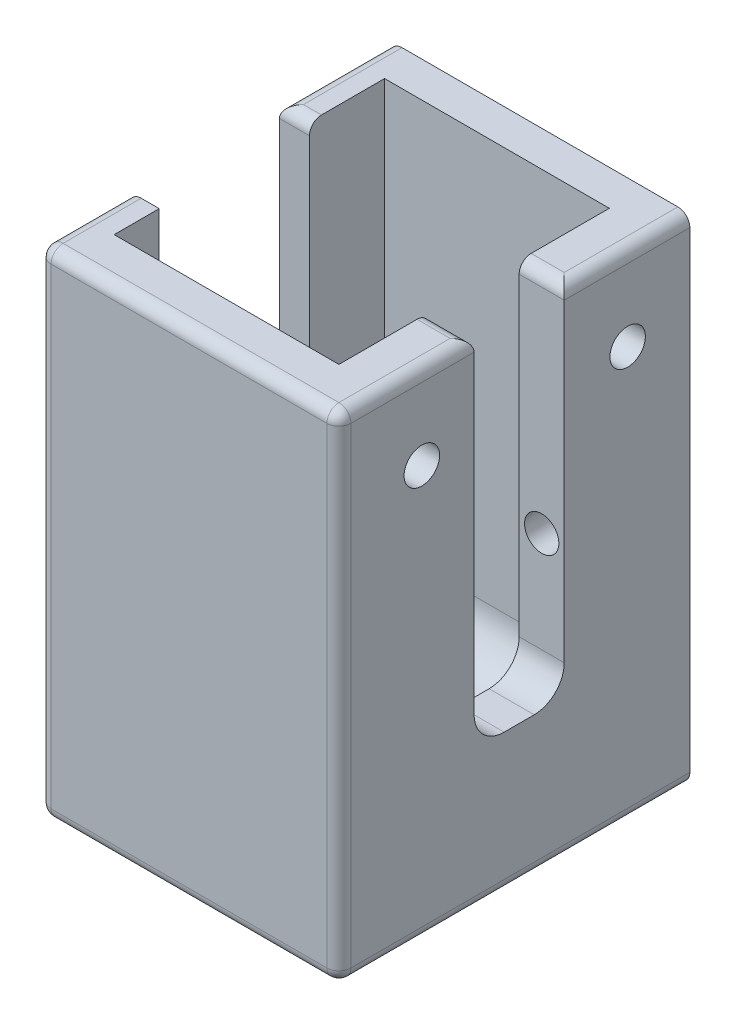
from build123d import *

# Parameters (mm, degrees)
BOSS_EXTRUDE2_DEPTH = 38.1
SKETCH1_W           = 25.35
SKETCH1_H           = 29.67
BOSS_EXTRUDE3_DEPTH = 3.81
SKETCH3_W           = 3
SKETCH3_H           = 7.62
CUT_EXTRUDE1_DEPTH  = 44.139583911
SKETCH4_W           = 7.62
SKETCH4_H           = 30.1
CUT_EXTRUDE2_DEPTH  = 47.344786115
SKETCH5_R           = 1.5
CUT_EXTRUDE3_DEPTH  = 47.344786115
SKETCH6_R           = 1.45
CUT_EXTRUDE4_DEPTH  = 24.844
FILLET1_R           = 4
FILLET4_R           = 2.54
FILLET2_R           = 1.016
FILLET3_R           = 1.27
FILLET5_R           = 1.016
CUT_EXTRUDE5_DEPTH  = 1.27
CUT_EXTRUDE6_DEPTH  = 1.27


with BuildPart() as part:
    # Sketch2 → Boss-Extrude2 (new body)
    with BuildSketch(Plane(origin=(0, 0, 0), x_dir=(1, 0, 0), z_dir=(0, 1, 0))):
        Polygon((-9.5, -11.43), (9.5, -11.43), (9.5, -5.08), (12.04, -5.08), (12.04, -14.43), (-13.31, -14.43), (-13.31, 15.24), (12.04, 15.24), (12.04, 7.62), (9.5, 7.62), (9.5, 11.43), (-9.5, 11.43), align=None)
    extrude(amount=BOSS_EXTRUDE2_DEPTH)

    # Sketch1 → Boss-Extrude3 (add)
    with BuildSketch(Plane(origin=(0, 0, 0), x_dir=(1, 0, 0), z_dir=(0, 1, 0))):
        with Locations((-0.635, 0.405)):
            Rectangle(SKETCH1_W, SKETCH1_H)
    extrude(amount=-BOSS_EXTRUDE3_DEPTH)

    # Sketch3 → Cut-Extrude1 (cut, through all)
    with BuildSketch(Plane(origin=(0, 0, 0), x_dir=(1, 0, 0), z_dir=(0, 1, 0))):
        with Locations((-0.38, 0)):
            Rectangle(SKETCH3_W, SKETCH3_H)
    extrude(amount=-CUT_EXTRUDE1_DEPTH, mode=Mode.SUBTRACT)

    # Sketch4 → Cut-Extrude2 (cut, through all)
    with BuildSketch(Plane(origin=(-9.5, 0, 0), x_dir=(0, 0, -1), z_dir=(1, 0, 0))):
        with Locations((0, 23.05)):
            Rectangle(SKETCH4_W, SKETCH4_H)
    extrude(amount=-CUT_EXTRUDE2_DEPTH, mode=Mode.SUBTRACT)

    # Sketch5 → Cut-Extrude3 (cut, through all)
    with BuildSketch(Plane(origin=(-9.5, 0, 0), x_dir=(0, 0, -1), z_dir=(1, 0, 0))):
        with Locations((-9.1700096, 31)):
            Circle(SKETCH5_R)
        with Locations((8.2299904, 31)):
            Circle(SKETCH5_R)
    extrude(amount=-CUT_EXTRUDE3_DEPTH, mode=Mode.SUBTRACT)

    # Sketch6 → Cut-Extrude4 (cut)
    with BuildSketch(Plane.XY.offset(14.43)):
        with Locations((-11.405, 19.05)):
            Circle(SKETCH6_R)
        with Locations((-3.81, -1.905)):
            Circle(SKETCH6_R)
    extrude(amount=-CUT_EXTRUDE4_DEPTH, mode=Mode.SUBTRACT)

    # Fillet1
    fillet1_edges = [part.edges().sort_by_distance(p)[0] for p in [
        (0, 0, -11.43),
        (0, 0, 11.43),
    ]]
    fillet(fillet1_edges, radius=FILLET1_R)


with BuildPart() as body_2:
    # Mirror1: mirrored copy
    add(part.part.mirror(Plane.XY))

    # Fillet4
    fillet4_edges = [body_2.edges().sort_by_distance(p)[0] for p in [
        (-11.405, 8, -3.81),
        (-11.405, 8, 3.81),
    ]]
    fillet(fillet4_edges, radius=FILLET4_R)

    # Fillet2
    fillet2_edges = [body_2.edges().sort_by_distance(p)[0] for p in [
        (-13.31, 17.145, 15.24),
        (12.04, 17.145, 15.24),
        (12.04, -3.81, 0.405),
        (-13.31, -3.81, 0.405),
        (-0.635, -3.81, 15.24),
        (12.04, 38.1, 11.43),
        (-0.635, 38.1, 15.24),
        (-13.31, 38.1, 9.525),
        (-13.31, 38.1, -9.12),
        (-11.405, 38.1, -3.81),
        (-11.405, 38.1, 3.81),
    ]]
    fillet(fillet2_edges, radius=FILLET2_R)

    # Fillet3
    fillet3_edges = [body_2.edges().sort_by_distance(p)[0] for p in [
        (-1.88, 0, 0),
        (-0.38, 0, -3.81),
        (1.12, 0, 0),
        (-0.38, 0, 3.81),
    ]]
    fillet(fillet3_edges, radius=FILLET3_R)

    # Fillet5
    fillet5_edges = [body_2.edges().sort_by_distance(p)[0] for p in [
        (12.04, 38.1, -9.755),
        (10.77, 38.1, -5.08),
    ]]
    fillet(fillet5_edges, radius=FILLET5_R)


with BuildPart() as body_2_2:
    # Mirror3: mirrored copy
    add(body_2.part.mirror(Plane.ZY.offset(15.85)))

    # Sketch8 → Cut-Extrude6 (cut)
    # profile 1 of 2: a face of its own
    with BuildSketch(Plane(origin=(0, 0, 0), x_dir=(1, 0, 0), z_dir=(0, 1, 0))):
        Polygon((-35.125709402, -4.085355142), (-35.125709402, -4.750205569), (-37.310217949, -4.750205569), (-37.310217949, -5.699991894), (-37.975068376, -5.699991894), (-37.975068376, -4.750205569), (-42.724, -4.750205569), (-42.724, -4.085355142), (-37.975068376, -4.085355142), (-37.975068376, -3.135568817), (-37.310217949, -3.135568817), (-37.310217949, -4.085355142), align=None)
    # profile 2 of 2: a face of its own
    with BuildSketch(Plane(origin=(0, 0, 0), x_dir=(1, 0, 0), z_dir=(0, 1, 0))):
        with BuildLine():
            Line((-35.315666667, 2.658127764), (-35.315666667, 1.175570673))
            add(Edge.make_bspline(
                [(-35.315666667, 1.175570673), (-35.31599599, 1.076635284), (-35.316628328, 0.886668378), (-35.320154193, 0.614521623), (-35.330259913, 0.367237601), (-35.338956414, 0.144945608), (-35.354814357, -0.052350279), (-35.36997106, -0.225255044), (-35.389811975, -0.372972337), (-35.408238454, -0.462392723), (-35.416581464, -0.502879848)],
                knots=[0, 0, 0, 0, 1.410062039, 2.707475311, 3.878576406, 4.937260626, 5.877586885, 6.699081471, 7.410979367, 8, 8, 8, 8], degree=3))
            add(Edge.make_bspline(
                [(-35.416581464, -0.502879848), (-35.429971598, -0.557081491), (-35.456466218, -0.664328507), (-35.512494413, -0.81872563), (-35.577224639, -0.965915382), (-35.653842803, -1.105345402), (-35.741012521, -1.237028627), (-35.839243094, -1.360767889), (-35.949034771, -1.475855736), (-36.067583937, -1.583177714), (-36.195924968, -1.680461633), (-36.332188282, -1.764648136), (-36.475521634, -1.836736616), (-36.626424162, -1.894287018), (-36.783620234, -1.940584552), (-36.948482467, -1.973239748), (-37.120273858, -1.992820602), (-37.237448007, -1.99481431), (-37.296861579, -1.995825227)],
                knots=[0, 0, 0, 0, 1.02737288, 2.032829108, 3.019628684, 3.985738875, 4.958353778, 5.924249254, 6.890702889, 7.883913451, 8.865824512, 9.85161466, 10.829249435, 11.81541824, 12.821369441, 13.843154991, 14.906364023, 16, 16, 16, 16], degree=3))
            add(Edge.make_bspline(
                [(-37.296861579, -1.995825227), (-37.395572664, -1.992715929), (-37.588183557, -1.986648882), (-37.867710836, -1.930079619), (-38.128467354, -1.83742344), (-38.370090229, -1.709723959), (-38.587996871, -1.547178937), (-38.778744039, -1.351836783), (-38.939838712, -1.124695094), (-39.050363857, -0.91224832), (-39.121480472, -0.724494941), (-39.171769577, -0.569470973), (-39.209969011, -0.400237622), (-39.244686959, -0.219222799), (-39.271179543, -0.025028326), (-39.289994312, 0.181954737), (-39.302092352, 0.402244067), (-39.303859928, 0.553246562), (-39.304769231, 0.630927577)],
                knots=[0, 0, 0, 0, 1.260402266, 2.459371274, 3.627181936, 4.786749125, 5.93865593, 7.087644312, 8.261344208, 9.485713728, 10.136162886, 10.825977872, 11.566646758, 12.35154167, 13.181268117, 14.0701832, 15.007234106, 16, 16, 16, 16], degree=3))
            Line((-39.304769231, 0.630927577), (-42.724, -2.09080386))
            Line((-42.724, -2.09080386), (-42.724, -1.268645072))
            Line((-42.724, -1.268645072), (-39.304769231, 1.453086364))
            Line((-39.304769231, 1.453086364), (-39.304769231, 1.993277337))
            Line((-39.304769231, 1.993277337), (-42.724, 1.993277337))
            Line((-42.724, 1.993277337), (-42.724, 2.658127764))
            Line((-42.724, 2.658127764), (-35.315666667, 2.658127764))
        make_face()
        with BuildLine():
            Line((-36.075495726, 1.993277337), (-38.544940171, 1.993277337))
            Line((-38.544940171, 1.993277337), (-38.555328459, 0.636863742))
            add(Edge.make_bspline(
                [(-38.555328459, 0.636863742), (-38.555356476, 0.573532993), (-38.555410782, 0.450779964), (-38.546957292, 0.27319022), (-38.537340592, 0.107835996), (-38.522631175, -0.044650303), (-38.503674054, -0.184336572), (-38.479961405, -0.31115373), (-38.452333452, -0.425306376), (-38.409577922, -0.55844757), (-38.341800903, -0.707074645), (-38.243358644, -0.86880077), (-38.118738571, -1.006056387), (-37.978502281, -1.124397331), (-37.821144229, -1.215549999), (-37.653648946, -1.281893149), (-37.477462473, -1.323527172), (-37.356448737, -1.328476869), (-37.295377537, -1.3309748)],
                knots=[0, 0, 0, 0, 1.14660753, 2.222451964, 3.218720504, 4.145691244, 4.995719623, 5.770487122, 6.480909919, 7.121111896, 8.299844659, 9.430703709, 10.534634535, 11.641396424, 12.741395289, 13.810956493, 14.895269934, 16, 16, 16, 16], degree=3))
            add(Edge.make_bspline(
                [(-37.295377537, -1.3309748), (-37.235784101, -1.328469191), (-37.117691657, -1.323503988), (-36.945281883, -1.281812481), (-36.781395026, -1.214486794), (-36.629154879, -1.120080599), (-36.489810496, -1.006005192), (-36.372231955, -0.870523684), (-36.27376678, -0.720459089), (-36.211303642, -0.580102451), (-36.172931546, -0.454736188), (-36.145962748, -0.345871562), (-36.124112719, -0.222396299), (-36.107124734, -0.084606312), (-36.091837488, 0.067249114), (-36.081925643, 0.233585788), (-36.075934923, 0.414211629), (-36.075645532, 0.539406498), (-36.075495726, 0.604214837)],
                knots=[0, 0, 0, 0, 1.100801541, 2.181386982, 3.260112282, 4.364594493, 5.481957178, 6.577424609, 7.668452592, 8.790448866, 9.403819393, 10.091598921, 10.863153553, 11.720938239, 12.658472417, 13.685008818, 14.801622349, 16, 16, 16, 16], degree=3))
            Line((-36.075495726, 0.604214837), (-36.075495726, 1.993277337))
        make_face(mode=Mode.SUBTRACT)
    extrude(amount=-CUT_EXTRUDE6_DEPTH, mode=Mode.SUBTRACT)


with BuildPart() as body_2_1:
    add(body_2.part)

    # Sketch7 → Cut-Extrude5 (cut)
    with BuildSketch(Plane(origin=(0, 0, 0), x_dir=(1, 0, 0), z_dir=(0, 1, 0))):
        Polygon((4.129986879, -2.992887734), (4.129986879, -2.328037307), (10.778491153, -2.328037307), (10.778491153, 0.521321667), (11.538320213, 0.521321667), (11.538320213, -2.992887734), align=None)
        Polygon((3.940029614, 2.230937052), (3.940029614, 2.895787479), (6.124538161, 2.895787479), (6.124538161, 3.845573804), (6.789388589, 3.845573804), (6.789388589, 2.895787479), (11.538320213, 2.895787479), (11.538320213, 2.230937052), (6.789388589, 2.230937052), (6.789388589, 1.281150727), (6.124538161, 1.281150727), (6.124538161, 2.230937052), align=None)
    extrude(amount=-CUT_EXTRUDE5_DEPTH, mode=Mode.SUBTRACT)


solid = body_2_2.part
